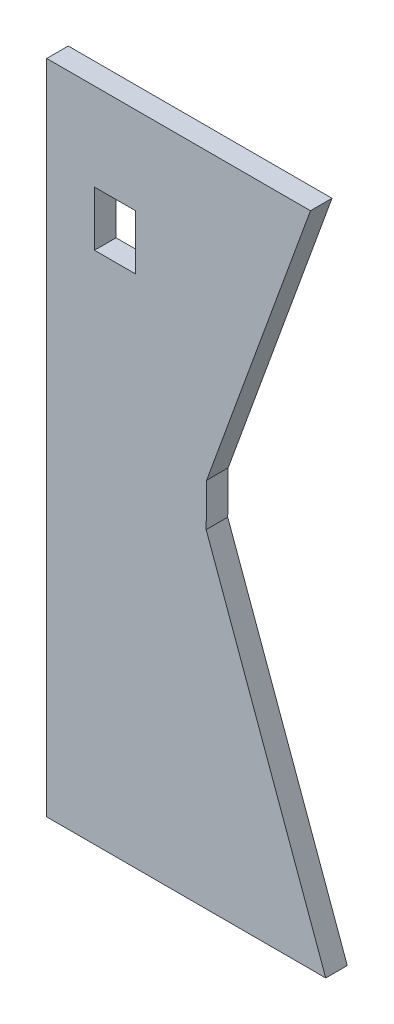
from build123d import *

# Parameters (mm, degrees)
SKETCH1_W           = 25.4
SKETCH1_H           = 19.05
BOSS_EXTRUDE1_DEPTH = 10


with BuildPart() as part:
    # Sketch1 → Boss-Extrude1 (new body)
    with BuildSketch(Plane(origin=(0, 0, 0), x_dir=(0, 1, 0), z_dir=(0, 0, 1))):
        Polygon((-152.4, 64.740720078), (152.4, 64.740720078), (152.4, -57.650472485), (19.992548652, -9.458101399), (0.039573298, -9.257252873), (-152.4, -64.740720078), align=None)
        with Locations((99.107046087, 33.035450901)):
            Rectangle(SKETCH1_W, SKETCH1_H, mode=Mode.SUBTRACT)
    extrude(amount=BOSS_EXTRUDE1_DEPTH)


solid = part.part
